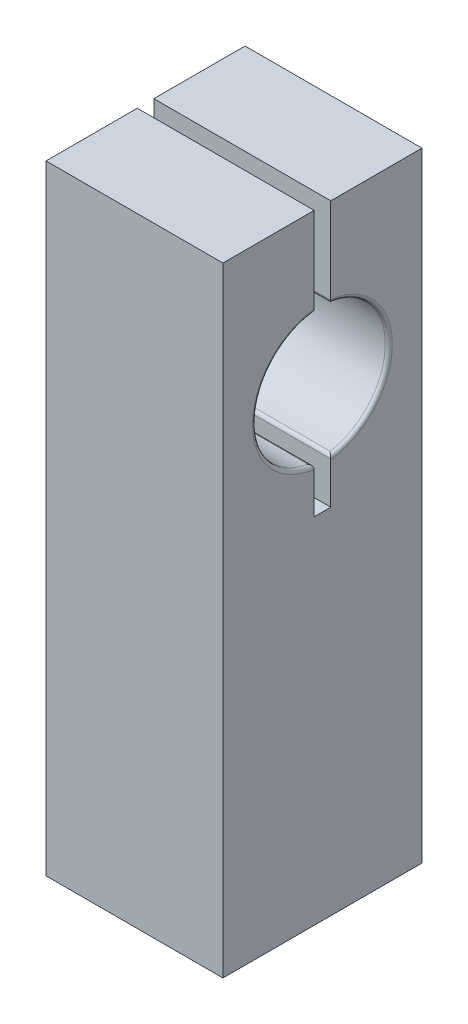
from build123d import *

# Parameters (mm, degrees)
SKETCH1_W           = 25.4
SKETCH1_H           = 28.575
BOSS_EXTRUDE1_DEPTH = 88.9
CUT_EXTRUDE1_REACH  = 98.772
FILLET1_R           = 0.508


with BuildPart() as part:
    # Sketch1 → Boss-Extrude1 (new body)
    with BuildSketch(Plane(origin=(0, 0, 0), x_dir=(1, 0, 0), z_dir=(0, 1, 0))):
        with Locations((12.7, 14.2875)):
            Rectangle(SKETCH1_W, SKETCH1_H)
    extrude(amount=BOSS_EXTRUDE1_DEPTH)

    # Sketch2 → Cut-Extrude1 (cut, up to next)
    with BuildSketch(Plane(origin=(25.4, 0, 0), x_dir=(0, 0, -1), z_dir=(1, 0, 0)), mode=Mode.PRIVATE) as cut_extrude1_sk1:
        with BuildLine():
            Line((13.096875, 50.8), (15.478125, 50.8))
            Line((15.478125, 50.8), (15.478125, 57.224707036))
            ThreePointArc((15.478125, 57.224707036), (23.8125, 66.675), (15.478125, 76.125292964))
            Line((15.478125, 76.125292964), (15.478125, 88.9))
            Line((15.478125, 88.9), (13.096875, 88.9))
            Line((13.096875, 88.9), (13.096875, 76.125292964))
            ThreePointArc((13.096875, 76.125292964), (4.7625, 66.675), (13.096875, 57.224707036))
            Line((13.096875, 57.224707036), (13.096875, 50.8))
        make_face()
    cut_extrude1_tool1 = extrude(cut_extrude1_sk1.sketch, amount=-CUT_EXTRUDE1_REACH, mode=Mode.PRIVATE) & part.part
    add(cut_extrude1_tool1.solids().sort_by_distance((25.4, 67.546559, -14.2875))[0], mode=Mode.SUBTRACT)

    # Fillet1
    fillet1_edges = [part.edges().sort_by_distance(p)[0] for p in [
        (12.7, 57.224707036, -13.096875),
        (12.7, 76.125292964, -13.096875),
        (12.7, 76.125292964, -15.478125),
        (12.7, 57.224707036, -15.478125),
        (25.4, 66.675, -23.8125),
        (25.4, 66.675, -4.7625),
        (0, 66.675, -4.7625),
        (0, 66.675, -23.8125),
    ]]
    fillet(fillet1_edges, radius=FILLET1_R)


solid = part.part
